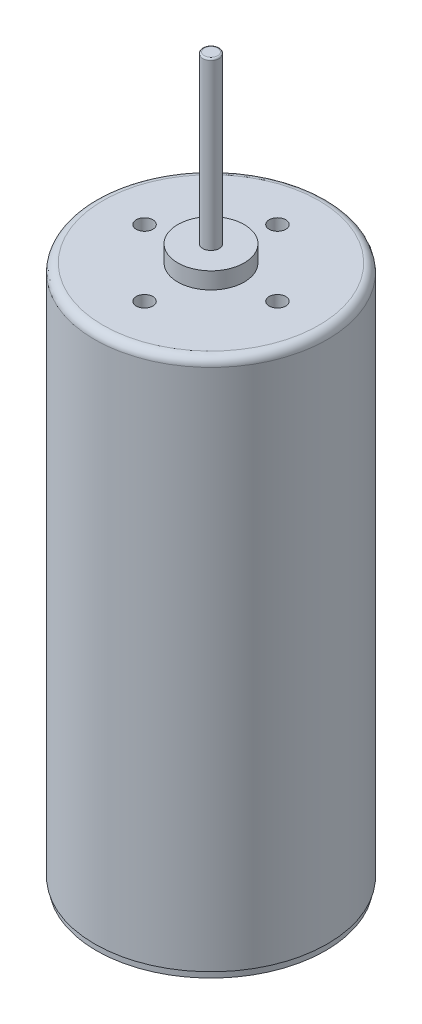
from build123d import *

# Parameters (mm, degrees)
ESBO_O1_R                = 3.5
RESSALTO_EXTRUS_O1_DEPTH = 16
ESBO_O2_R                = 3.45
RESSALTO_EXTRUS_O2_DEPTH = 0.2
ESBO_O3_R                = 0.375
CORTE_EXTRUS_O1_DEPTH    = 0.5
ESBO_O4_R                = 1
RESSALTO_EXTRUS_O3_DEPTH = 0.5
ESBO_O5_R                = 0.25
RESSALTO_EXTRUS_O4_DEPTH = 5
FILETE1_R                = 0.25
FILETE2_R                = 0.05
ESBO_O6_R                = 0.25
CORTE_EXTRUS_O2_DEPTH    = 1


with BuildPart() as part:
    # Esboço1 → Ressalto-extrusão1 (new body)
    with BuildSketch(Plane(origin=(0, 0, 0), x_dir=(1, 0, 0), z_dir=(0, 1, 0))):
        with Locations(Location((0, 0, 0), (0, 0, 270))):
            Circle(ESBO_O1_R)
    extrude(amount=RESSALTO_EXTRUS_O1_DEPTH)

    # Esboço2 → Ressalto-extrusão2 (add)
    with BuildSketch(Plane.XZ):
        with Locations(Location((0, 0, 0), (0, 0, 270))):
            Circle(ESBO_O2_R)
    extrude(amount=RESSALTO_EXTRUS_O2_DEPTH)

    # Esboço3 → Corte-extrusão1 (cut)
    with BuildSketch(Plane.XZ.offset(0.2)):
        with Locations(Location((-2.5, 0, 0), (0, 0, 270))):
            Circle(ESBO_O3_R)
        with Locations(Location((2.5, 0, 0), (0, 0, 270))):
            Circle(ESBO_O3_R)
    extrude(amount=-CORTE_EXTRUS_O1_DEPTH, mode=Mode.SUBTRACT)

    # Esboço4 → Ressalto-extrusão3 (add)
    with BuildSketch(Plane(origin=(0, 16, 0), x_dir=(1, 0, 0), z_dir=(0, 1, 0))):
        with Locations(Location((0, 0, 0), (0, 0, 270))):
            Circle(ESBO_O4_R)
    extrude(amount=RESSALTO_EXTRUS_O3_DEPTH)

    # Esboço5 → Ressalto-extrusão4 (add)
    with BuildSketch(Plane(origin=(0, 16.5, 0), x_dir=(1, 0, 0), z_dir=(0, 1, 0))):
        with Locations(Location((0, 0, 0), (0, 0, 270))):
            Circle(ESBO_O5_R)
    extrude(amount=RESSALTO_EXTRUS_O4_DEPTH)

    # Filete1
    filete1_edges = [part.edges().sort_by_distance(p)[0] for p in [
        (0, 16, -3.5),
    ]]
    fillet(filete1_edges, radius=FILETE1_R)

    # Filete2
    filete2_edges = [part.edges().sort_by_distance(p)[0] for p in [
        (0, 21.5, -0.25),
    ]]
    fillet(filete2_edges, radius=FILETE2_R)

    # Esboço6 → Corte-extrusão2 (cut)
    with BuildSketch(Plane(origin=(0, 16, 0), x_dir=(1, 0, 0), z_dir=(0, 1, 0))):
        with Locations(Location((0, 2, 0), (0, 0, 270))):
            Circle(ESBO_O6_R)
        with Locations(Location((2, 0, 0), (0, 0, 270))):
            Circle(ESBO_O6_R)
        with Locations(Location((0, -2, 0), (0, 0, 270))):
            Circle(ESBO_O6_R)
        with Locations(Location((-2, 0, 0), (0, 0, 270))):
            Circle(ESBO_O6_R)
    extrude(amount=-CORTE_EXTRUS_O2_DEPTH, mode=Mode.SUBTRACT)


solid = part.part
